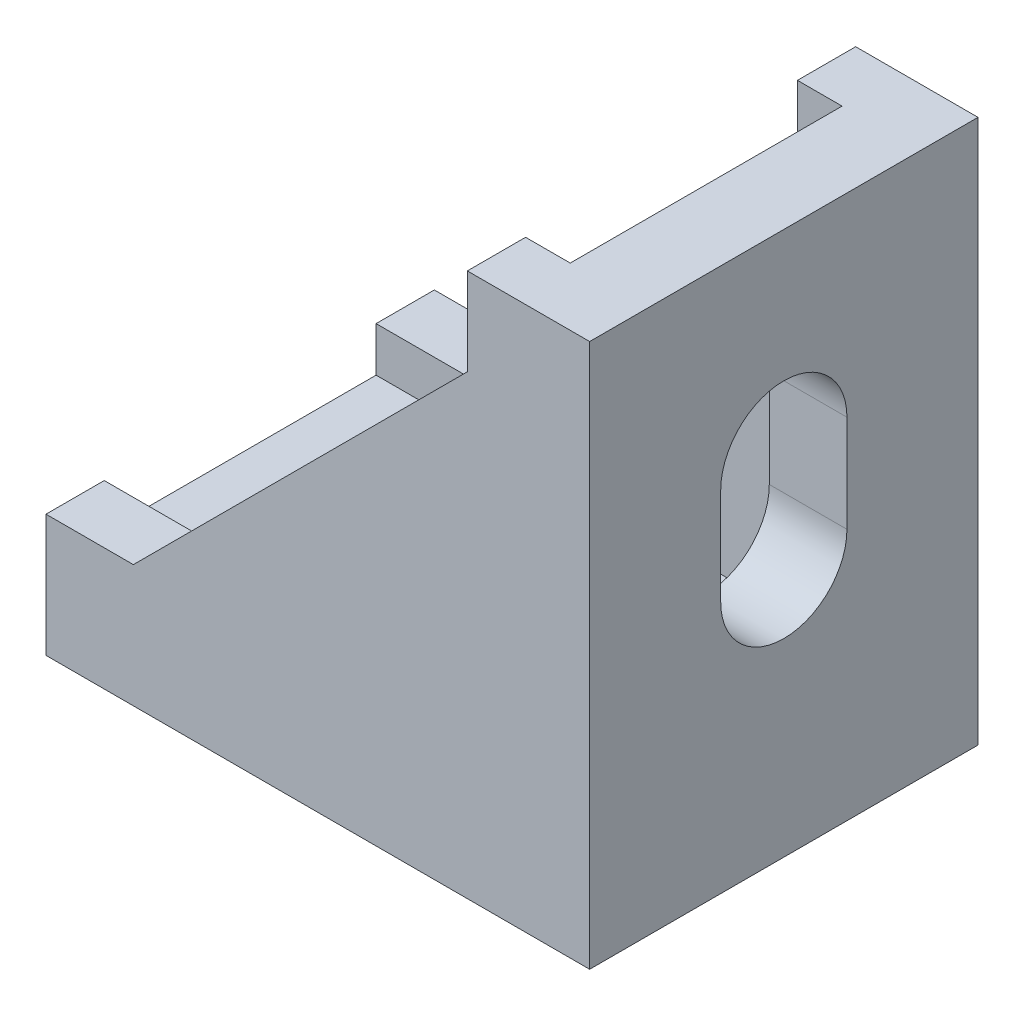
from build123d import *

# Parameters (mm, degrees)
EXTRUDE_1_DEPTH     = 20
EXTRUDE_2_DEPTH     = 3
CUT_EXTRUDE_2_DEPTH = 35.234485537
CUT_EXTRUDE_3_DEPTH = 35.234485537


with BuildPart() as part:
    # 草图1 → 凸台-拉伸1 (new body)
    with BuildSketch(Plane.XY):
        Polygon((14, -14), (-14, -14), (-14, -10), (10, -10), (10, 14), (14, 14), align=None)
    extrude(amount=EXTRUDE_1_DEPTH)

    # 草图3 → 凸台-拉伸2 (add)
    with BuildSketch(Plane(origin=(0, 0, 0), x_dir=(-1, 0, 0), z_dir=(0, 0, -1))):
        Polygon((-10, 14), (-7.7, 14), (-7.7, 9.5), (9.5, -7.7), (14, -7.7), (14, -10), (14, -14), (-14, -14), (-14, 14), align=None)
    extrude_2 = extrude(amount=-EXTRUDE_2_DEPTH)

    # 镜向2: 凸台-拉伸2 across plane
    add(extrude_2.mirror(Plane.XY.offset(10)))

    # 草图6 → 切除-拉伸2 (cut, through all)
    with BuildSketch(Plane.ZY.offset(-10)):
        with BuildLine():
            Line((13.25, 4), (13.25, -1))
            ThreePointArc((13.25, -1), (10, -4.25), (6.75, -1))
            Line((6.75, -1), (6.75, 4))
            ThreePointArc((6.75, 4), (10, 7.25), (13.25, 4))
        make_face()
    extrude(amount=-CUT_EXTRUDE_2_DEPTH, mode=Mode.SUBTRACT)

    # 草图8 → 切除-拉伸3 (cut, through all)
    with BuildSketch(Plane(origin=(0, -10, 0), x_dir=(1, 0, 0), z_dir=(0, 1, 0))):
        with BuildLine():
            Line((-4, -6.75), (1, -6.75))
            ThreePointArc((1, -6.75), (4.25, -10), (1, -13.25))
            Line((1, -13.25), (-4, -13.25))
            ThreePointArc((-4, -13.25), (-7.25, -10), (-4, -6.75))
        make_face()
    extrude(amount=-CUT_EXTRUDE_3_DEPTH, mode=Mode.SUBTRACT)


solid = part.part
